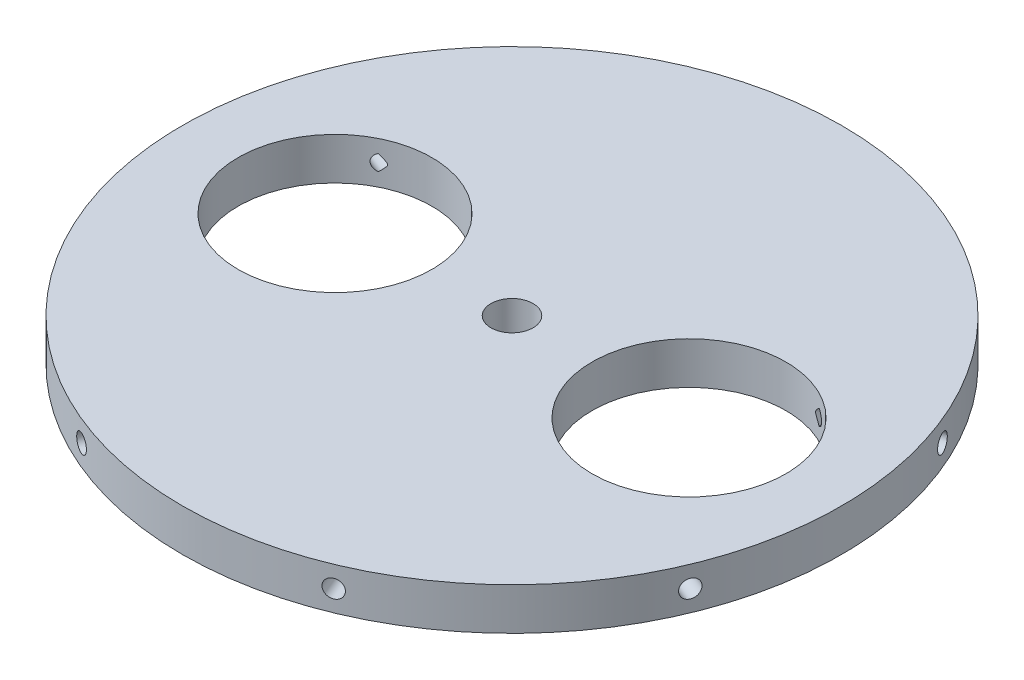
from build123d import *

# Parameters (mm, degrees)
SKETCH2_R           = 49.657
BOSS_EXTRUDE1_DEPTH = 6.35
SKETCH3_R           = 14.605
CUT_EXTRUDE1_DEPTH  = 6.35
SKETCH5_R           = 3.175
CUT_EXTRUDE2_DEPTH  = 6.35
CIRPATTERN1_COUNT   = 8


with BuildPart() as part:
    # Sketch2 → Boss-Extrude1 (new body)
    with BuildSketch(Plane(origin=(0, 0, 0), x_dir=(1, 0, 0), z_dir=(0, 1, 0))):
        with Locations(Location((0, 0, 0), (0, 0, 270))):
            Circle(SKETCH2_R)
    extrude(amount=BOSS_EXTRUDE1_DEPTH)

    # Sketch3 → Cut-Extrude1 (cut)
    with BuildSketch(Plane(origin=(0, 6.35, 0), x_dir=(1, 0, 0), z_dir=(0, 1, 0))):
        with Locations(Location((26.67, 0, 0), (0, 0, 270))):
            Circle(SKETCH3_R)
        with Locations(Location((-26.67, 0, 0), (0, 0, 270))):
            Circle(SKETCH3_R)
    extrude(amount=-CUT_EXTRUDE1_DEPTH, mode=Mode.SUBTRACT)

    # Sketch5 → Cut-Extrude2 (cut)
    with BuildSketch(Plane.XZ):
        with Locations(Location((0, 0, 0), (0, 0, 270))):
            Circle(SKETCH5_R)
    extrude(amount=-CUT_EXTRUDE2_DEPTH, mode=Mode.SUBTRACT)

    # Sketch8 → #6-32 Tapped Hole1 (revolve, cut)
    with BuildSketch(Plane(origin=(-19.002911201, 3.175, 45.877085946), x_dir=(0.9238795325112864, 0, 0.38268343236509056), z_dir=(0, 1, 0))):
        Polygon((0, 0), (0, 14.78269403), (1.35255, 13.97), (1.35255, 0), align=None)
    f_6_32_tapped_hole1 = revolve(axis=Axis((-21.432950996, 3.175, 51.743720977), (0.38268343236509056, 0, -0.9238795325112865)), mode=Mode.SUBTRACT)

    # CirPattern1: #6-32 Tapped Hole1 ×8 about axis
    cirpattern1_axis = Axis((0, -0.3175, 0), (0, 1, 0))
    for i in range(1, CIRPATTERN1_COUNT):
        add(f_6_32_tapped_hole1.rotate(cirpattern1_axis, i * 360 / CIRPATTERN1_COUNT), mode=Mode.SUBTRACT)


solid = part.part
